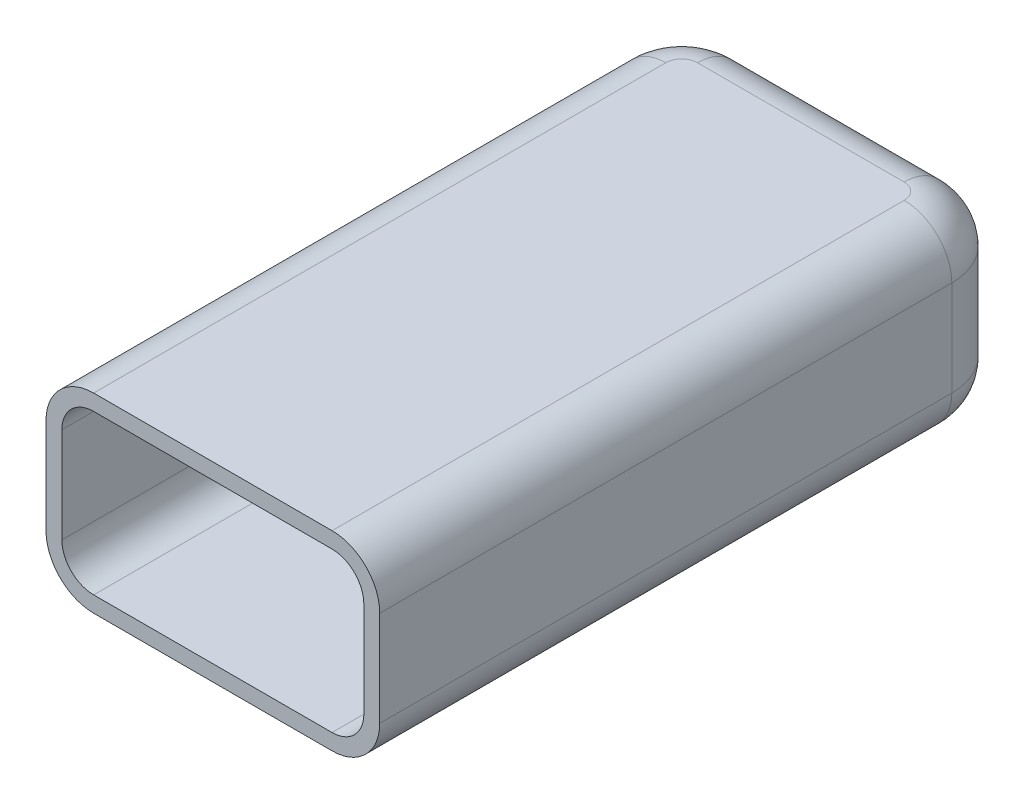
from build123d import *

# Parameters (mm, degrees)
SKETCH1_W           = 21
SKETCH1_H           = 40
BOSS_EXTRUDE1_DEPTH = 12
SKETCH4_W           = 19
SKETCH4_H           = 10
CUT_EXTRUDE2_DEPTH  = 35
FILLET5_R           = 4
FILLET6_R           = 3
FILLET8_R           = 2


with BuildPart() as part:
    # Sketch1 → Boss-Extrude1 (new body)
    with BuildSketch(Plane(origin=(0, 0, 0), x_dir=(1, 0, 0), z_dir=(0, 1, 0))):
        with Locations((10.5, 20)):
            Rectangle(SKETCH1_W, SKETCH1_H)
    extrude(amount=BOSS_EXTRUDE1_DEPTH)

    # Sketch4 → Cut-Extrude2 (cut)
    with BuildSketch(Plane.XY):
        with Locations((10.5, 6)):
            Rectangle(SKETCH4_W, SKETCH4_H)
    extrude(amount=-CUT_EXTRUDE2_DEPTH, mode=Mode.SUBTRACT)

    # Fillet5
    fillet5_edges = [part.edges().sort_by_distance(p)[0] for p in [
        (0, 6, -40),
        (21, 6, -40),
    ]]
    fillet(fillet5_edges, radius=FILLET5_R)

    # Fillet6
    fillet6_edges = [part.edges().sort_by_distance(p)[0] for p in [
        (21, 12, -18),
        (0, 0, -18),
        (0, 12, -18),
        (10.5, 0, -40),
        (19.828427125, 0, -38.828427125),
        (1.171572875, 0, -38.828427125),
        (10.5, 12, -40),
        (19.828427125, 12, -38.828427125),
        (1.171572875, 12, -38.828427125),
        (21, 0, -18),
    ]]
    fillet(fillet6_edges, radius=FILLET6_R)

    # Fillet8
    fillet8_edges = [part.edges().sort_by_distance(p)[0] for p in [
        (20, 11, -17.5),
        (20, 1, -17.5),
        (1, 1, -17.5),
        (1, 11, -17.5),
    ]]
    fillet(fillet8_edges, radius=FILLET8_R)


solid = part.part
